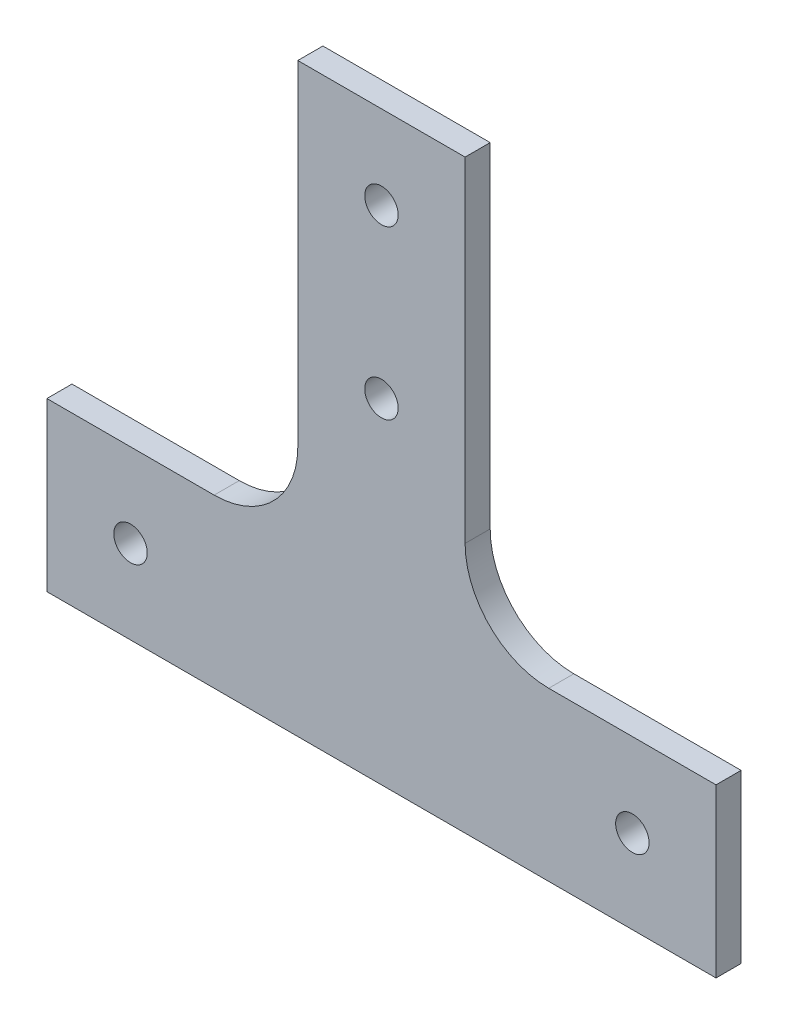
from build123d import *

# Parameters (mm, degrees)
SKETCH_1_W      = 20
SKETCH_1_H      = 50
SKETCH_1_R      = 2
SKETCH_1_W_2    = 80
SKETCH_1_H_2    = 20
EXTRUDE_1_DEPTH = 3
FILLET_1_R      = 10


with BuildPart() as part:
    # 草图1 → 凸台-拉伸1 (new body)
    # profile 1 of 2: a face of its own
    with BuildSketch(Plane.XY):
        with Locations((0, 35)):
            Rectangle(SKETCH_1_W, SKETCH_1_H)
        with Locations((0, 30)):
            Circle(SKETCH_1_R, mode=Mode.SUBTRACT)
        with Locations((0, 50)):
            Circle(SKETCH_1_R, mode=Mode.SUBTRACT)
    # profile 2 of 2: a face of its own
    with BuildSketch(Plane.XY):
        Rectangle(SKETCH_1_W_2, SKETCH_1_H_2)
        with Locations((30, 0)):
            Circle(SKETCH_1_R, mode=Mode.SUBTRACT)
        with Locations((-30, 0)):
            Circle(SKETCH_1_R, mode=Mode.SUBTRACT)
    extrude(amount=EXTRUDE_1_DEPTH)

    # 圆角1
    fillet_1_edges = [part.edges().sort_by_distance(p)[0] for p in [
        (10, 10, 1.5),
        (-10, 10, 1.5),
    ]]
    fillet(fillet_1_edges, radius=FILLET_1_R)


solid = part.part
